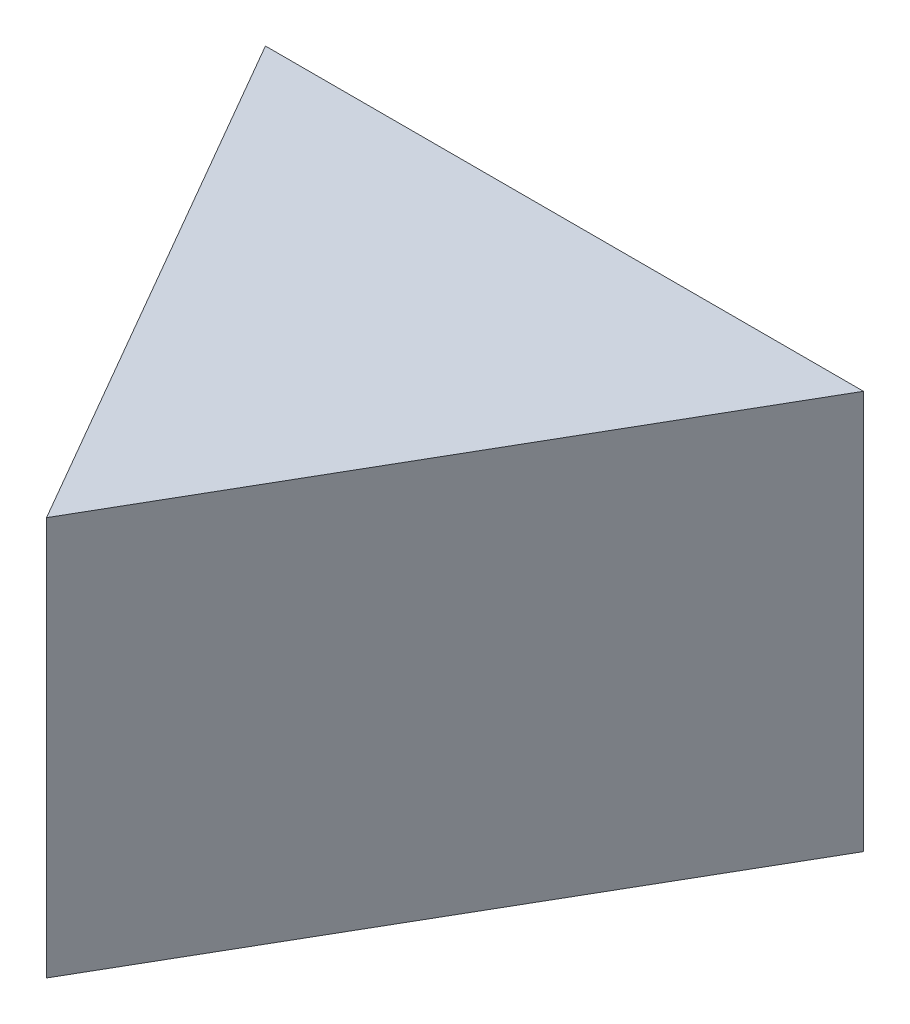
from build123d import *

# Parameters (mm, degrees)
BOSS_EXTRUDE2_DEPTH      = 25.4
BOSS_EXTRUDE2_DEPTH_BACK = 25.4


with BuildPart() as part:
    # Sketch1 → Boss-Extrude2 (new, two sides: drawn at the far end of the back side and taken through both)
    with BuildSketch(Plane(origin=(0, 0, 0), x_dir=(1, 0, 0), z_dir=(0, 1, 0)).offset(-BOSS_EXTRUDE2_DEPTH_BACK)):
        Polygon((0, -43.994090512), (38.1, 21.997045256), (-38.1, 21.997045256), align=None)
    extrude(amount=BOSS_EXTRUDE2_DEPTH + BOSS_EXTRUDE2_DEPTH_BACK)


solid = part.part
